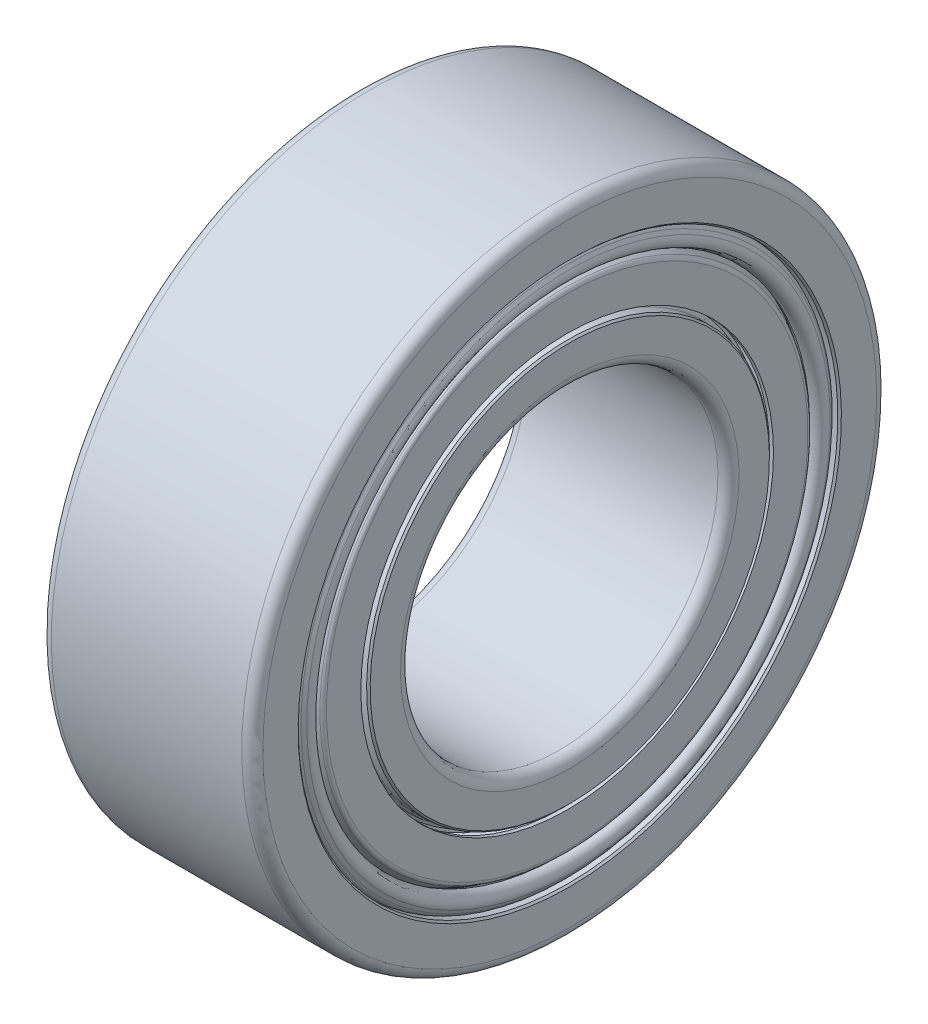
from build123d import *


with BuildPart() as part:
    # Sketch3 → Revolve1 (revolve)
    with BuildSketch(Plane.XY, mode=Mode.PRIVATE) as revolve1_sk:
        with BuildLine():
            Line((-1.8, 6), (1.8, 6))
            ThreePointArc((1.8, 6), (1.941421356, 5.941421356), (2, 5.8))
            Line((2, 5.8), (2, 5.13375))
            Line((2, 5.13375), (1.96625, 5.1))
            Line((1.96625, 5.1), (1.7, 5.1))
            Line((1.7, 5.1), (1.7, 5.154))
            Line((1.7, 5.154), (-1.7, 5.154))
            Line((-1.7, 5.154), (-1.7, 5.1))
            Line((-1.7, 5.1), (-1.96625, 5.1))
            Line((-1.96625, 5.1), (-2, 5.13375))
            Line((-2, 5.13375), (-2, 5.8))
            ThreePointArc((-2, 5.8), (-1.941421356, 5.941421356), (-1.8, 6))
        make_face()
        with BuildLine():
            Line((-1.96625, 3.8071875), (-2, 3.7734375))
            Line((-2, 3.7734375), (-2, 3.2))
            ThreePointArc((-2, 3.2), (-1.941421356, 3.058578644), (-1.8, 3))
            Line((-1.8, 3), (1.8, 3))
            ThreePointArc((1.8, 3), (1.941421356, 3.058578644), (2, 3.2))
            Line((2, 3.2), (2, 3.7734375))
            Line((2, 3.7734375), (1.96625, 3.8071875))
            Line((1.96625, 3.8071875), (1.7890625, 3.8071875))
            ThreePointArc((1.7890625, 3.8071875), (1.710589214, 3.832877337), (1.6625, 3.9))
            Line((1.6625, 3.9), (1.6625, 3.954))
            Line((1.6625, 3.954), (-1.6625, 3.954))
            Line((-1.6625, 3.954), (-1.6625, 3.9))
            ThreePointArc((-1.6625, 3.9), (-1.710589214, 3.832877337), (-1.7890625, 3.8071875))
            Line((-1.7890625, 3.8071875), (-1.96625, 3.8071875))
        make_face()
    revolve(revolve1_sk.sketch.rotate(Axis((-1.8, 0, 0), (1, 0, 0)), 180), axis=Axis((-1.8, 0, 0), (1, 0, 0)))


with BuildPart() as body_2:
    # Sketch4 → Revolve-Thin1 (revolve)
    with BuildSketch(Plane.XY, mode=Mode.PRIVATE) as revolve_thin1_sk:
        with BuildLine():
            ThreePointArc((1.833333333, 4.775717968), (1.91127562, 4.820717968), (1.91127562, 4.910717968))
            Line((1.91127562, 4.910717968), (1.87127562, 4.98))
            ThreePointArc((1.87127562, 4.98), (1.770039619, 5.021933324), (1.703333333, 4.935))
            Line((1.703333333, 4.935), (1.703333333, 4.756021417))
            ThreePointArc((1.703333333, 4.756021417), (1.706012825, 4.746021417), (1.713333333, 4.738700908))
            Line((1.713333333, 4.738700908), (1.905, 4.628042107))
            ThreePointArc((1.905, 4.628042107), (1.937942286, 4.595099821), (1.95, 4.550099821))
            Line((1.95, 4.550099821), (1.95, 3.9))
            Line((1.95, 3.9), (1.875, 3.9))
            Line((1.875, 3.9), (1.875, 4.550099821))
            ThreePointArc((1.875, 4.550099821), (1.872990381, 4.557599821), (1.8675, 4.563090202))
            Line((1.8675, 4.563090202), (1.675833333, 4.673749003))
            ThreePointArc((1.675833333, 4.673749003), (1.64106092, 4.708521417), (1.628333333, 4.756021417))
            Line((1.628333333, 4.756021417), (1.628333333, 4.935))
            ThreePointArc((1.628333333, 4.935), (1.750628191, 5.094377761), (1.936227525, 5.0175))
            Line((1.936227525, 5.0175), (1.976227525, 4.948217968))
            ThreePointArc((1.976227525, 4.948217968), (1.976227525, 4.783217968), (1.833333333, 4.700717968))
            Line((1.833333333, 4.700717968), (1.833333333, 4.775717968))
        make_face()
    revolve(revolve_thin1_sk.sketch.rotate(Axis((-1.8, 0, 0), (1, 0, 0)), 180), axis=Axis((-1.8, 0, 0), (1, 0, 0)))


with BuildPart() as body_3:
    # Mirror2: mirrored copy
    add(body_2.part.mirror(Plane(origin=(0, 0, 0), x_dir=(0, 0, 1), z_dir=(1, 0, 0))))


with BuildPart() as body_3_2:
    # Mirror1: mirrored copy
    add(body_2.part.mirror(Plane(origin=(0, 0, 0), x_dir=(0, 0, 1), z_dir=(1, 0, 0))))


solid = Compound([part.part, body_2.part, body_3_2.part])
